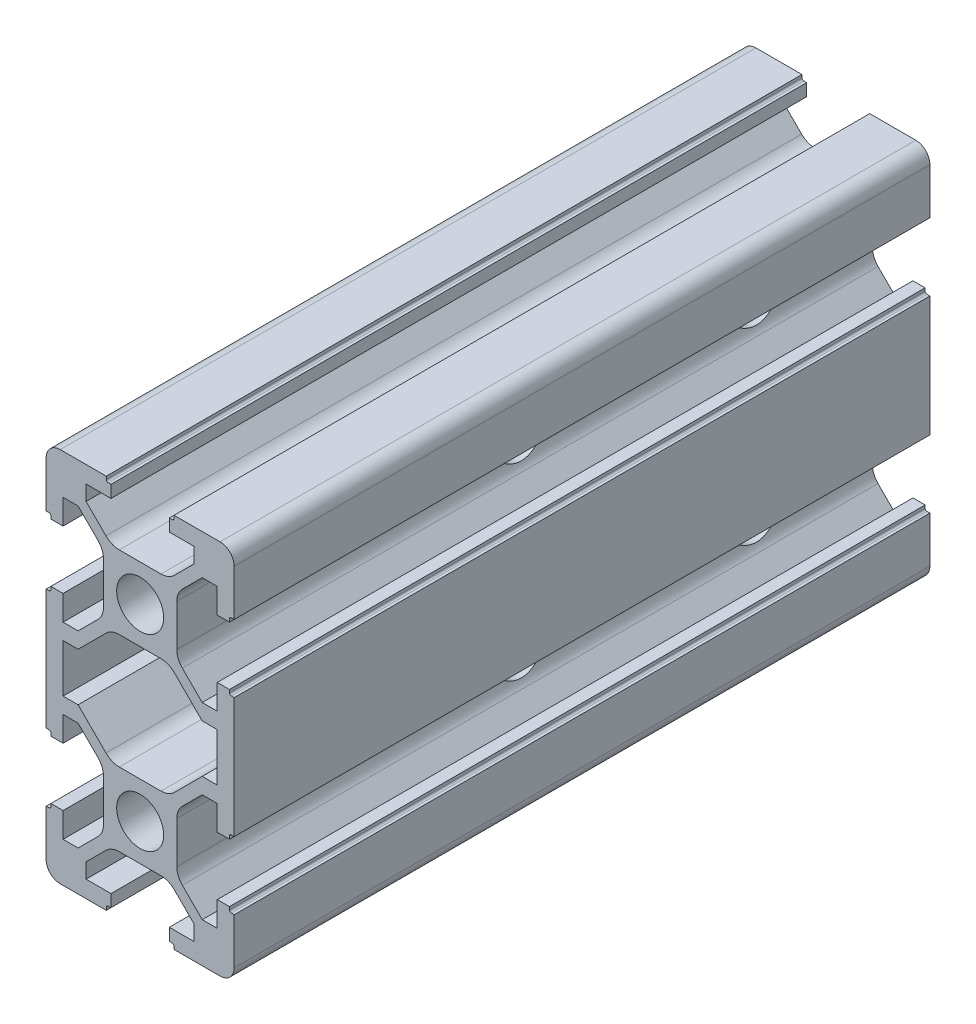
from build123d import *

# Parameters (mm, degrees)
CROQUIS3_R              = 2.5
SALIENTE_EXTRUIR3_DEPTH = 175
SKETCH1_W               = 4.862742591
SKETCH1_H               = 276
SKETCH1_W_2             = 1.5
SKETCH1_W_3             = 0.035786438
CUT_EXTRUDE3_DEPTH      = 100
F_6_0MM_DOWEL_HOLE1_D   = 6


with BuildPart() as part:
    # Croquis3 → Saliente-Extruir3 (new, symmetric)
    with BuildSketch(Plane.XY):
        with BuildLine():
            Line((-9.5, -13.101470971), (-9.5, -13.401470971))
            ThreePointArc((-9.5, -13.401470971), (-9.558578644, -13.542892327), (-9.7, -13.601470971))
            Line((-9.7, -13.601470971), (-10, -13.601470971))
            Line((-10, -13.601470971), (-10, -18.5))
            ThreePointArc((-10, -18.5), (-9.560660172, -19.560660172), (-8.5, -20))
            Line((-8.5, -20), (-3.601470971, -20))
            Line((-3.601470971, -20), (-3.601470971, -19.7))
            ThreePointArc((-3.601470971, -19.7), (-3.542892327, -19.558578644), (-3.401470971, -19.5))
            Line((-3.401470971, -19.5), (-3.101470971, -19.5))
            Line((-3.101470971, -19.5), (-3.101470971, -18.2))
            Line((-3.101470971, -18.2), (-5.751470971, -18.2))
            Line((-5.751470971, -18.2), (-5.751470971, -16.6))
            Line((-5.751470971, -16.6), (-3.637257409, -14.485786438))
            ThreePointArc((-3.637257409, -14.485786438), (-2.988410711, -14.052240935), (-2.223043846, -13.9))
            Line((-2.223043846, -13.9), (2.223043846, -13.9))
            ThreePointArc((2.223043846, -13.9), (2.988410711, -14.052240935), (3.637257409, -14.485786438))
            Line((3.637257409, -14.485786438), (5.751470971, -16.6))
            Line((5.751470971, -16.6), (5.751470971, -18.2))
            Line((5.751470971, -18.2), (3.101470971, -18.2))
            Line((3.101470971, -18.2), (3.101470971, -19.5))
            Line((3.101470971, -19.5), (3.401470971, -19.5))
            ThreePointArc((3.401470971, -19.5), (3.542892327, -19.558578644), (3.601470971, -19.7))
            Line((3.601470971, -19.7), (3.601470971, -20))
            Line((3.601470971, -20), (8.5, -20))
            ThreePointArc((8.5, -20), (9.560660172, -19.560660172), (10, -18.5))
            Line((10, -18.5), (10, -13.601470971))
            Line((10, -13.601470971), (9.7, -13.601470971))
            ThreePointArc((9.7, -13.601470971), (9.558578644, -13.542892327), (9.5, -13.401470971))
            Line((9.5, -13.401470971), (9.5, -13.101470971))
            Line((9.5, -13.101470971), (8.2, -13.101470971))
            Line((8.2, -13.101470971), (8.2, -15.751470971))
            Line((8.2, -15.751470971), (6.6, -15.751470971))
            Line((6.6, -15.751470971), (4.485786438, -13.637257409))
            ThreePointArc((4.485786438, -13.637257409), (4.052240935, -12.988410711), (3.9, -12.223043846))
            Line((3.9, -12.223043846), (3.9, -7.776956154))
            ThreePointArc((3.9, -7.776956154), (4.052507548, -7.010945946), (4.486771639, -6.361758076))
            Line((4.486771639, -6.361758076), (6.6, -4.251470971))
            Line((6.6, -4.251470971), (8.2, -4.251470971))
            Line((8.2, -4.251470971), (8.2, -6.901470971))
            Line((8.2, -6.901470971), (9.5, -6.901470971))
            Line((9.5, -6.901470971), (9.5, -6.601470971))
            ThreePointArc((9.5, -6.601470971), (9.558578644, -6.460049615), (9.7, -6.401470971))
            Line((9.7, -6.401470971), (10, -6.401470971))
            Line((10, -6.401470971), (10, 6.401470971))
            Line((10, 6.401470971), (9.7, 6.401470971))
            ThreePointArc((9.7, 6.401470971), (9.558578644, 6.460049615), (9.5, 6.601470971))
            Line((9.5, 6.601470971), (9.5, 6.901470971))
            Line((9.5, 6.901470971), (8.2, 6.901470971))
            Line((8.2, 6.901470971), (8.2, 4.251470971))
            Line((8.2, 4.251470971), (6.6, 4.251470971))
            Line((6.6, 4.251470971), (4.486771639, 6.361758076))
            ThreePointArc((4.486771639, 6.361758076), (4.052507548, 7.010945946), (3.9, 7.776956154))
            Line((3.9, 7.776956154), (3.9, 12.223043846))
            ThreePointArc((3.9, 12.223043846), (4.052240935, 12.988410711), (4.485786438, 13.637257409))
            Line((4.485786438, 13.637257409), (6.6, 15.751470971))
            Line((6.6, 15.751470971), (8.2, 15.751470971))
            Line((8.2, 15.751470971), (8.2, 13.101470971))
            Line((8.2, 13.101470971), (9.5, 13.101470971))
            Line((9.5, 13.101470971), (9.5, 13.401470971))
            ThreePointArc((9.5, 13.401470971), (9.558578644, 13.542892327), (9.7, 13.601470971))
            Line((9.7, 13.601470971), (10, 13.601470971))
            Line((10, 13.601470971), (10, 18.5))
            ThreePointArc((10, 18.5), (9.560660172, 19.560660172), (8.5, 20))
            Line((8.5, 20), (3.601470971, 20))
            Line((3.601470971, 20), (3.601470971, 19.7))
            ThreePointArc((3.601470971, 19.7), (3.542892327, 19.558578644), (3.401470971, 19.5))
            Line((3.401470971, 19.5), (3.101470971, 19.5))
            Line((3.101470971, 19.5), (3.101470971, 18.2))
            Line((3.101470971, 18.2), (5.751470971, 18.2))
            Line((5.751470971, 18.2), (5.751470971, 16.6))
            Line((5.751470971, 16.6), (3.637257409, 14.485786438))
            ThreePointArc((3.637257409, 14.485786438), (2.988410711, 14.052240935), (2.223043846, 13.9))
            Line((2.223043846, 13.9), (-2.223043846, 13.9))
            ThreePointArc((-2.223043846, 13.9), (-2.988410711, 14.052240935), (-3.637257409, 14.485786438))
            Line((-3.637257409, 14.485786438), (-5.751470971, 16.6))
            Line((-5.751470971, 16.6), (-5.751470971, 18.2))
            Line((-5.751470971, 18.2), (-3.101470971, 18.2))
            Line((-3.101470971, 18.2), (-3.101470971, 19.5))
            Line((-3.101470971, 19.5), (-3.401470971, 19.5))
            ThreePointArc((-3.401470971, 19.5), (-3.542892327, 19.558578644), (-3.601470971, 19.7))
            Line((-3.601470971, 19.7), (-3.601470971, 20))
            Line((-3.601470971, 20), (-8.5, 20))
            ThreePointArc((-8.5, 20), (-9.560660172, 19.560660172), (-10, 18.5))
            Line((-10, 18.5), (-10, 13.601470971))
            Line((-10, 13.601470971), (-9.7, 13.601470971))
            ThreePointArc((-9.7, 13.601470971), (-9.558578644, 13.542892327), (-9.5, 13.401470971))
            Line((-9.5, 13.401470971), (-9.5, 13.101470971))
            Line((-9.5, 13.101470971), (-8.2, 13.101470971))
            Line((-8.2, 13.101470971), (-8.2, 15.751470971))
            Line((-8.2, 15.751470971), (-6.6, 15.751470971))
            Line((-6.6, 15.751470971), (-4.485786438, 13.637257409))
            ThreePointArc((-4.485786438, 13.637257409), (-4.052240935, 12.988410711), (-3.9, 12.223043846))
            Line((-3.9, 12.223043846), (-3.9, 7.776956154))
            ThreePointArc((-3.9, 7.776956154), (-4.052507548, 7.010945946), (-4.486771639, 6.361758076))
            Line((-4.486771639, 6.361758076), (-6.6, 4.251470971))
            Line((-6.6, 4.251470971), (-8.2, 4.251470971))
            Line((-8.2, 4.251470971), (-8.2, 6.901470971))
            Line((-8.2, 6.901470971), (-9.5, 6.901470971))
            Line((-9.5, 6.901470971), (-9.5, 6.601470971))
            ThreePointArc((-9.5, 6.601470971), (-9.558578644, 6.460049615), (-9.7, 6.401470971))
            Line((-9.7, 6.401470971), (-10, 6.401470971))
            Line((-10, 6.401470971), (-10, -6.401470971))
            Line((-10, -6.401470971), (-9.7, -6.401470971))
            ThreePointArc((-9.7, -6.401470971), (-9.558578644, -6.460049615), (-9.5, -6.601470971))
            Line((-9.5, -6.601470971), (-9.5, -6.901470971))
            Line((-9.5, -6.901470971), (-8.2, -6.901470971))
            Line((-8.2, -6.901470971), (-8.2, -4.251470971))
            Line((-8.2, -4.251470971), (-6.6, -4.251470971))
            Line((-6.6, -4.251470971), (-4.486771639, -6.361758076))
            ThreePointArc((-4.486771639, -6.361758076), (-4.052507548, -7.010945946), (-3.9, -7.776956154))
            Line((-3.9, -7.776956154), (-3.9, -12.223043846))
            ThreePointArc((-3.9, -12.223043846), (-4.052240935, -12.988410711), (-4.485786438, -13.637257409))
            Line((-4.485786438, -13.637257409), (-6.6, -15.751470971))
            Line((-6.6, -15.751470971), (-8.2, -15.751470971))
            Line((-8.2, -15.751470971), (-8.2, -13.101470971))
            Line((-8.2, -13.101470971), (-9.5, -13.101470971))
        make_face()
        with Locations((0, -10)):
            Circle(CROQUIS3_R, mode=Mode.SUBTRACT)
        with Locations(Location((0, 10, 0), (0, 0, 180))):
            Circle(CROQUIS3_R, mode=Mode.SUBTRACT)
        with BuildLine():
            Line((-3.636272208, -5.515198077), (-6.6, -2.555595292))
            Line((-6.6, -2.555595292), (-8.2, -2.555595292))
            Line((-8.2, -2.555595292), (-8.2, 2.555595292))
            Line((-8.2, 2.555595292), (-6.6, 2.555595292))
            Line((-6.6, 2.555595292), (-3.636272208, 5.515198077))
            ThreePointArc((-3.636272208, 5.515198077), (-2.987767275, 5.948025454), (-2.223043846, 6.1))
            Line((-2.223043846, 6.1), (2.223043846, 6.1))
            ThreePointArc((2.223043846, 6.1), (2.987767275, 5.948025454), (3.636272208, 5.515198077))
            Line((3.636272208, 5.515198077), (6.6, 2.555595292))
            Line((6.6, 2.555595292), (8.2, 2.555595292))
            Line((8.2, 2.555595292), (8.2, -2.555595292))
            Line((8.2, -2.555595292), (6.6, -2.555595292))
            Line((6.6, -2.555595292), (3.636272208, -5.515198077))
            ThreePointArc((3.636272208, -5.515198077), (2.987767275, -5.948025454), (2.223043846, -6.1))
            Line((2.223043846, -6.1), (-2.223043846, -6.1))
            ThreePointArc((-2.223043846, -6.1), (-2.987767275, -5.948025454), (-3.636272208, -5.515198077))
        make_face(mode=Mode.SUBTRACT)
    extrude(amount=SALIENTE_EXTRUIR3_DEPTH, both=True)

    # Sketch1 → Cut-Extrude3 (cut)
    with BuildSketch(Plane(origin=(0, 20, 0), x_dir=(1, 0, 0), z_dir=(0, 1, 0))):
        Polygon((3.637257409, -175), (8.5, -175), (10, -175), (10, 101), (3.637257409, 101), align=None)
        Polygon((2.223043846, -175), (3.601470971, -175), (3.601470971, 101), (-3.601470971, 101), (-3.601470971, -175), (-2.223043846, -175), align=None)
        with Locations((-6.068628705, -37)):
            Rectangle(SKETCH1_W, SKETCH1_H)
        with Locations((-9.25, -37)):
            Rectangle(SKETCH1_W_2, SKETCH1_H)
        with Locations((-3.61936419, -37)):
            Rectangle(SKETCH1_W_3, SKETCH1_H)
        with Locations((3.61936419, -37)):
            Rectangle(SKETCH1_W_3, SKETCH1_H)
    extrude(amount=-CUT_EXTRUDE3_DEPTH, mode=Mode.SUBTRACT)

    # Ø6.0mm Dowel Hole1 (through all)
    with Locations(Plane(origin=(10, 0, 0), x_dir=(0, 0, -1), z_dir=(1, 0, 0))):
        with Locations((137.5, -10), (137.5, 10), (162.5, 10), (162.5, -10)):
            Hole(F_6_0MM_DOWEL_HOLE1_D / 2)


solid = part.part
